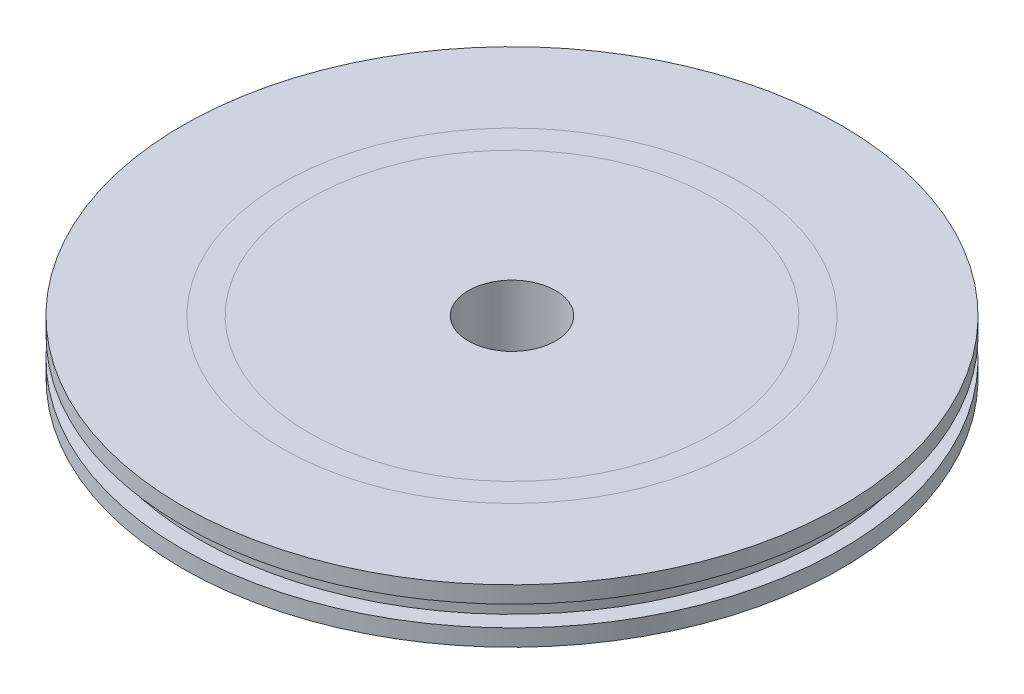
from build123d import *

# Parameters (mm, degrees)
SKETCH6_R                   = 4.1021
F_5_16_CLOSE_FIT_HOLE_DEPTH = 45.063579292
BOSS_EXTRUDE1_START         = 1.016
SKETCH7_R                   = 22.86
SKETCH7_R_2                 = 4.1021
BOSS_EXTRUDE1_DEPTH         = 1.016


with BuildPart() as part:
    # Sketch1 → Revolve1 (revolve)
    with BuildSketch(Plane(origin=(0, 0, 0), x_dir=(0, 0, -1), z_dir=(1, 0, 0))):
        Polygon((0, 0), (0, -5.08), (-30.9499, -5.08), (-30.9499, -3.5052), (-29.3878, -3.5052), (-29.3878, -1.5748), (-30.9499, -1.5748), (-30.9499, 0), align=None)
    revolve(axis=Axis((0, 0, 0), (0, -1, 0)))

    # Sketch6 → 5/16 Close Fit hole (cut, through all)
    with BuildSketch(Plane.XZ.offset(5.08)):
        with Locations(Location((0, 0, 0), (0, 0, 270))):
            Circle(SKETCH6_R)
    extrude(amount=-F_5_16_CLOSE_FIT_HOLE_DEPTH, mode=Mode.SUBTRACT)

    # Sketch7 → Boss-Extrude1 (add)
    with BuildSketch(Plane.XZ.offset(5.08).offset(BOSS_EXTRUDE1_START)):
        with Locations(Location((0, 0, 0), (0, 0, 270))):
            Circle(SKETCH7_R)
        with Locations(Location((0, 0, 0), (0, 0, 270))):
            Circle(SKETCH7_R_2, mode=Mode.SUBTRACT)
    extrude(amount=-BOSS_EXTRUDE1_DEPTH)


solid = part.part
